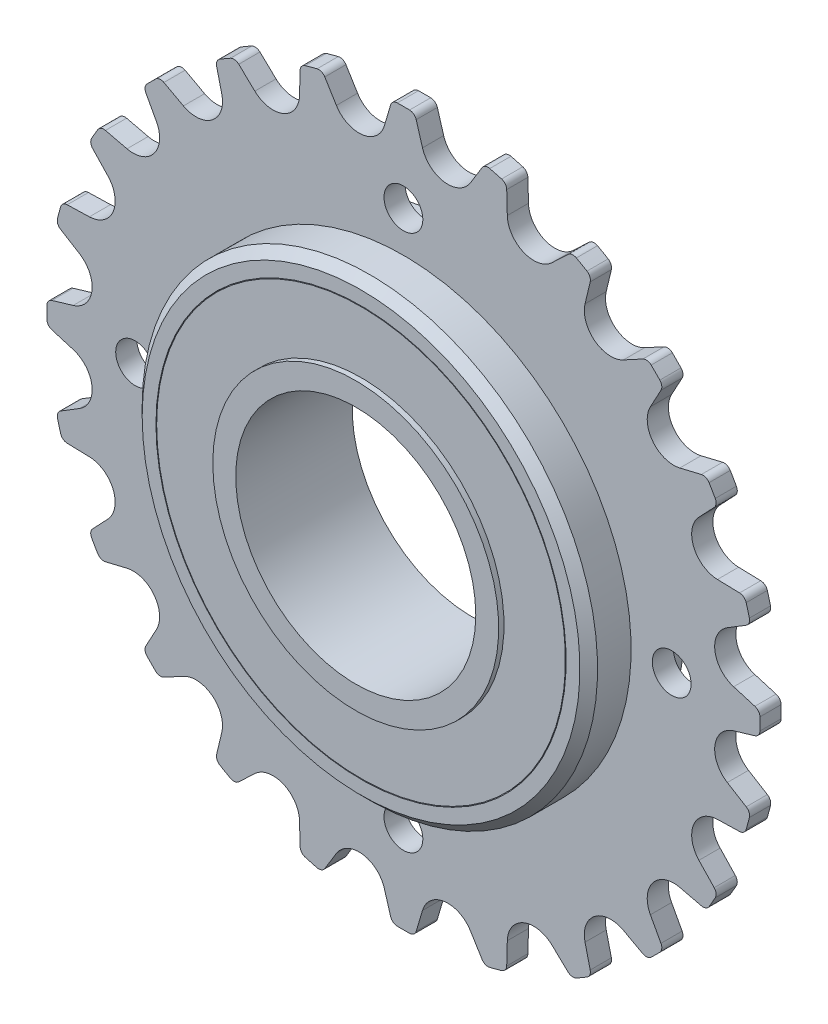
from build123d import *

# Parameters (mm, degrees)
M36X2_0_TAPPED_HOLE2_D   = 34
CUT_EXTRUDE1_DEPTH       = 72.892715208
FILLET1_R                = 1
CIRPATTERN1_COUNT        = 24
FILLET1_OF_CIRPATTERN1_R = 1
CUT_EXTRUDE2_DEPTH       = 72.892715208
CUT_EXTRUDE2_DEPTH_BACK  = 72.892715208
SKETCH8_R                = 2.75


with BuildPart() as part:
    # Sketch2 → Revolve1 (revolve)
    with BuildSketch(Plane(origin=(0, 0, 0), x_dir=(1, 0, 0), z_dir=(0, 1, 0)), mode=Mode.PRIVATE) as revolve1_sk:
        Polygon((20.25, -7.5), (28.95, -7.5), (28.95, -2.5), (29.05, -2.5), (29.05, -7.5), (31, -7.5), (32.25, -6.25), (32.25, -1.5), (50.5, -1.5), (50.5, 1.5), (32.25, 1.5), (32.25, 6.25), (31, 7.5), (29.05, 7.5), (29.05, 2.5), (28.95, 2.5), (28.95, 7.5), (20.25, 7.5), (20.25, 8.25), (10.25, 8.25), (10.25, -8.25), (20.25, -8.25), align=None)
    revolve(revolve1_sk.sketch.rotate(Axis((0, 0, -16.399249212), (0, 0, 1)), 180), axis=Axis((0, 0, -16.399249212), (0, 0, 1)))

    # M36x2.0 Tapped Hole2 (through all)
    with Locations(Plane.XY.offset(8.25)):
        with Locations((0, 0)):
            Hole(M36X2_0_TAPPED_HOLE2_D / 2)

    # Sketch7 → Cut-Extrude1 (cut, symmetric)
    with BuildSketch(Plane.XY):
        with BuildLine():
            ThreePointArc((11.51640898, 49.169322999), (6.591572707, 50.067965499), (1.601960367, 50.474584921))
            Line((1.601960367, 50.474584921), (2.703279593, 46.768905228))
            ThreePointArc((2.703279593, 46.768905228), (5.808415554, 44.119296331), (9.493515817, 45.87495367))
            Line((9.493515817, 45.87495367), (11.51640898, 49.169322999))
        make_face()
    cut_extrude1 = extrude(amount=CUT_EXTRUDE1_DEPTH, both=True, mode=Mode.SUBTRACT)

    # Fillet1
    fillet1_edges = [part.edges().sort_by_distance(p)[0] for p in [
        (11.51640898, 49.169322999, 0),
        (1.601960367, 50.474584921, 0),
    ]]
    fillet(fillet1_edges, radius=FILLET1_R)

    # CirPattern1: Cut-Extrude1 ×24 about axis
    cirpattern1_axis = Axis((0, 0, 0), (0, 0, 1))
    for i in range(1, CIRPATTERN1_COUNT):
        add(cut_extrude1.rotate(cirpattern1_axis, i * 360 / CIRPATTERN1_COUNT), mode=Mode.SUBTRACT)

    # Fillet1 of CirPattern1
    fillet1_of_cirpattern1_edges = [part.edges().sort_by_distance(p)[0] for p in [
        (-1.601960367, 50.474584921, 0),
        (-11.51640898, 49.169322999, 0),
        (-14.611158762, 48.340087294, 0),
        (-23.849954087, 44.513252971, 0),
        (-26.624630834, 42.911292604, 0),
        (-34.558164237, 36.823678314, 0),
        (-36.823678314, 34.558164237, 0),
        (-42.911292604, 26.624630834, 0),
        (-44.513252971, 23.849954087, 0),
        (-48.340087294, 14.611158762, 0),
        (-49.169322999, 11.51640898, 0),
        (-50.474584921, 1.601960367, 0),
        (-50.474584921, -1.601960367, 0),
        (-49.169322999, -11.51640898, 0),
        (-48.340087294, -14.611158762, 0),
        (-44.513252971, -23.849954087, 0),
        (-42.911292604, -26.624630834, 0),
        (-36.823678314, -34.558164237, 0),
        (-34.558164237, -36.823678314, 0),
        (-26.624630834, -42.911292604, 0),
        (-23.849954087, -44.513252971, 0),
        (-14.611158762, -48.340087294, 0),
        (-11.51640898, -49.169322999, 0),
        (-1.601960367, -50.474584921, 0),
        (1.601960367, -50.474584921, 0),
        (11.51640898, -49.169322999, 0),
        (14.611158762, -48.340087294, 0),
        (23.849954087, -44.513252971, 0),
        (26.624630834, -42.911292604, 0),
        (34.558164237, -36.823678314, 0),
        (36.823678314, -34.558164237, 0),
        (42.911292604, -26.624630834, 0),
        (44.513252971, -23.849954087, 0),
        (48.340087294, -14.611158762, 0),
        (49.169322999, -11.51640898, 0),
        (50.474584921, -1.601960367, 0),
        (50.474584921, 1.601960367, 0),
        (49.169322999, 11.51640898, 0),
        (48.340087294, 14.611158762, 0),
        (44.513252971, 23.849954087, 0),
        (42.911292604, 26.624630834, 0),
        (36.823678314, 34.558164237, 0),
        (34.558164237, 36.823678314, 0),
        (26.624630834, 42.911292604, 0),
        (23.849954087, 44.513252971, 0),
        (14.611158762, 48.340087294, 0),
    ]]
    fillet(fillet1_of_cirpattern1_edges, radius=FILLET1_OF_CIRPATTERN1_R)

    # Sketch8 → Cut-Extrude2 (cut, two sides: drawn at the far end of the back side and taken through both)
    with BuildSketch(Plane.XY.offset(-CUT_EXTRUDE2_DEPTH_BACK)):
        with Locations((0, 38)):
            Circle(SKETCH8_R)
        with Locations((38, 0)):
            Circle(SKETCH8_R)
        with Locations((0, -38)):
            Circle(SKETCH8_R)
        with Locations((-38, 0)):
            Circle(SKETCH8_R)
    extrude(amount=CUT_EXTRUDE2_DEPTH + CUT_EXTRUDE2_DEPTH_BACK, mode=Mode.SUBTRACT)


solid = part.part
